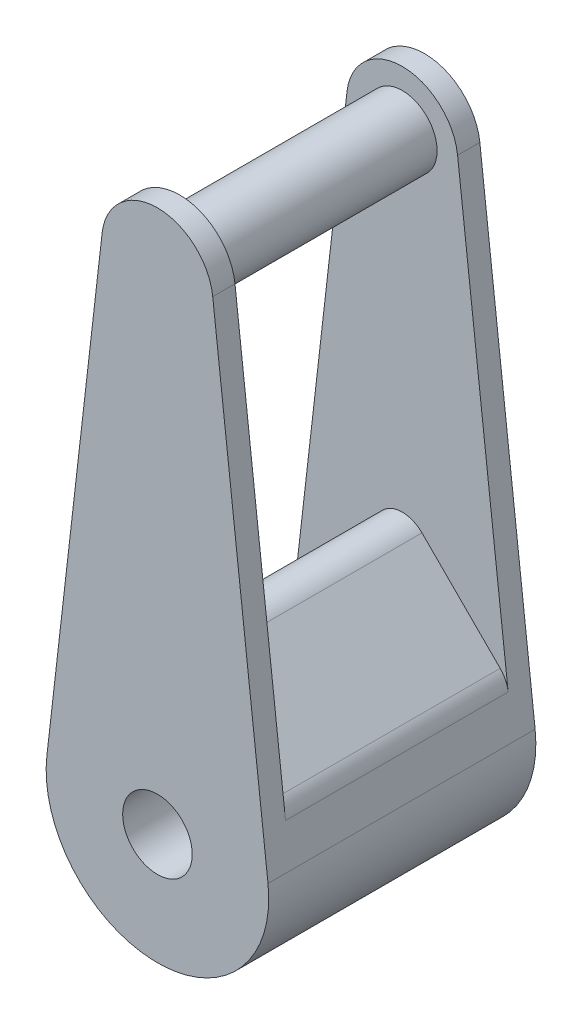
from build123d import *

# Parameters (mm, degrees)
SKETCH1_R           = 12.5
BOSS_EXTRUDE1_DEPTH = 40
BOSS_EXTRUDE2_DEPTH = 8
BOSS_EXTRUDE3_DEPTH = 80
SKETCH5_R           = 12.5
CUT_EXTRUDE1_DEPTH  = 96


with BuildPart() as part:
    # Sketch1 → Boss-Extrude1 (new, symmetric)
    with BuildSketch(Plane.XY):
        Circle(SKETCH1_R)
    extrude(amount=BOSS_EXTRUDE1_DEPTH, both=True)

    # Sketch2 → Boss-Extrude2 (add)
    with BuildSketch(Plane.XY.offset(40)):
        with BuildLine():
            Line((-19.868958458, 2.285714286), (-39.737916916, -170.428571429))
            ThreePointArc((-39.737916916, -170.428571429), (0, -215), (39.737916916, -170.428571429))
            Line((39.737916916, -170.428571429), (19.868958458, 2.285714286))
            ThreePointArc((19.868958458, 2.285714286), (0, 20), (-19.868958458, 2.285714286))
        make_face()
    boss_extrude2 = extrude(amount=BOSS_EXTRUDE2_DEPTH)

    # Mirror1: Boss-Extrude2 across plane
    add(boss_extrude2.mirror(Plane.XY))

    # Sketch4 → Boss-Extrude3 (add)
    with BuildSketch(Plane.XY.offset(-40)):
        with BuildLine():
            Line((-7.071067812, -121.645919803), (-35.177954833, -149.752806824))
            ThreePointArc((-35.177954833, -149.752806824), (-37.111501281, -152.47451583), (-38.04136625, -155.681017493))
            Line((-38.04136625, -155.681017493), (-39.737916916, -170.428571429))
            ThreePointArc((-39.737916916, -170.428571429), (0, -215), (39.737916916, -170.428571429))
            Line((39.737916916, -170.428571429), (38.04136625, -155.681017493))
            ThreePointArc((38.04136625, -155.681017493), (37.111501281, -152.47451583), (35.177954833, -149.752806824))
            Line((35.177954833, -149.752806824), (7.071067812, -121.645919803))
            ThreePointArc((7.071067812, -121.645919803), (0, -118.716987615), (-7.071067812, -121.645919803))
        make_face()
    extrude(amount=BOSS_EXTRUDE3_DEPTH)

    # Sketch5 → Cut-Extrude1 (cut)
    with BuildSketch(Plane(origin=(0, 0, -48), x_dir=(-1, 0, 0), z_dir=(0, 0, -1))):
        with Locations((0, -175)):
            Circle(SKETCH5_R)
    extrude(amount=-CUT_EXTRUDE1_DEPTH, mode=Mode.SUBTRACT)


solid = part.part
